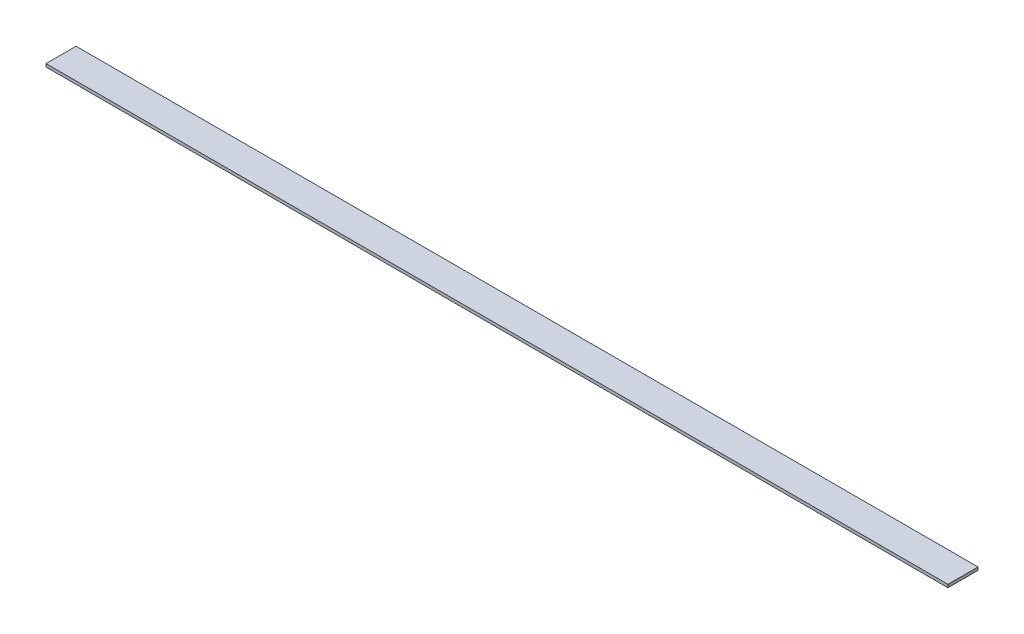
from build123d import *

# Parameters (mm, degrees)
SKETCH1_W           = 300
SKETCH1_H           = 1
BOSS_EXTRUDE1_DEPTH = 10


with BuildPart() as part:
    # Sketch1 → Boss-Extrude1 (new body)
    with BuildSketch(Plane.XY):
        Rectangle(SKETCH1_W, SKETCH1_H)
    extrude(amount=BOSS_EXTRUDE1_DEPTH)


solid = part.part
